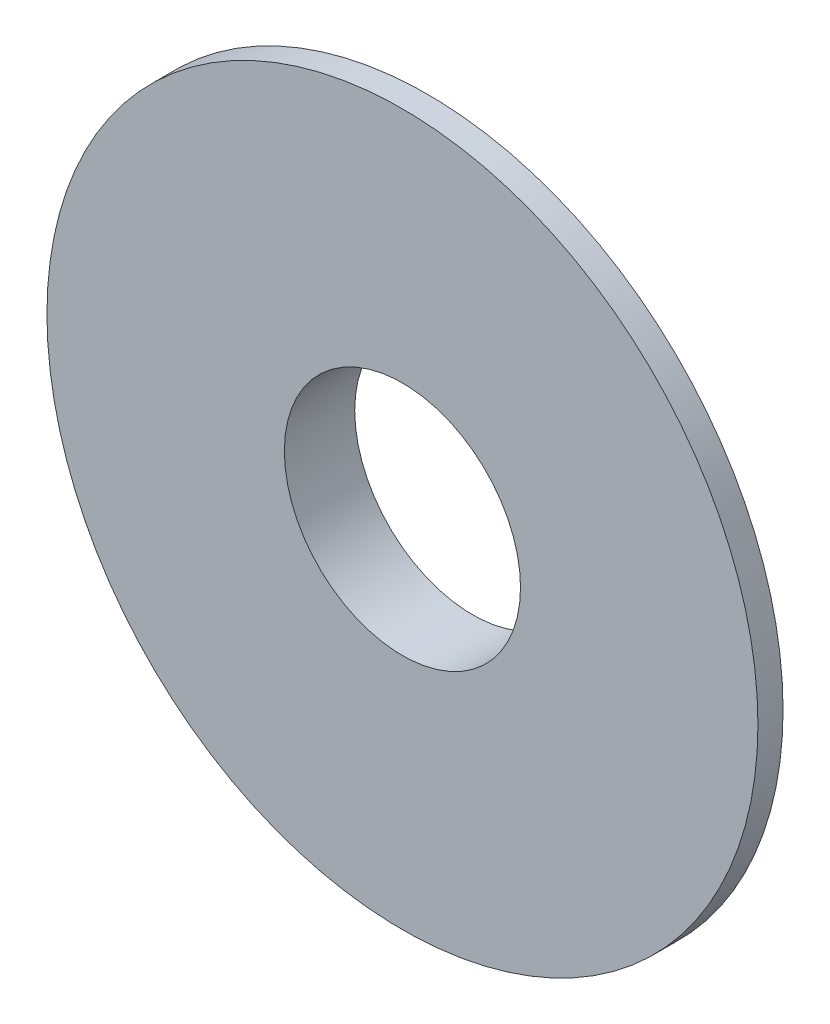
from build123d import *

# Parameters (mm, degrees)
COVER_WEB_START    = 35
SKETCH_1_R         = 70.753846154
SKETCH_1_R_2       = 23.5
COVER_WEB_DEPTH    = 5
BEARING_BOSS_START = 26
SKETCH_2_R         = 27.5
SKETCH_2_R_2       = 23.5
BEARING_BOSS_DEPTH = 14


with BuildPart() as part:
    # Эскиз1 → Cover_web (new body)
    with BuildSketch(Plane.XY.offset(COVER_WEB_START)):
        Circle(SKETCH_1_R)
        Circle(SKETCH_1_R_2, mode=Mode.SUBTRACT)
    extrude(amount=COVER_WEB_DEPTH)

    # Эскиз2 → Bearing_boss (add)
    with BuildSketch(Plane.XY.offset(BEARING_BOSS_START)):
        Circle(SKETCH_2_R)
        Circle(SKETCH_2_R_2, mode=Mode.SUBTRACT)
    extrude(amount=BEARING_BOSS_DEPTH)


solid = part.part
